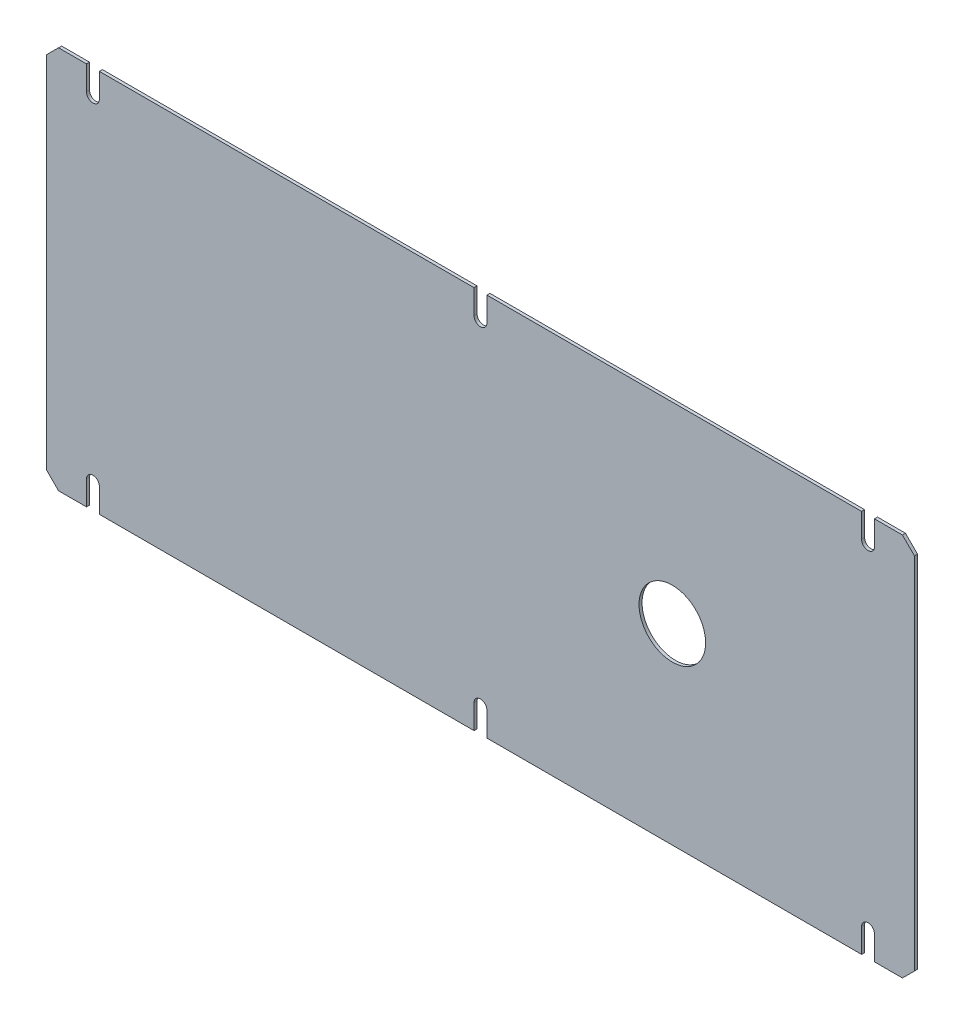
from build123d import *

# Parameters (mm, degrees)
SKETCH1_W               = 455.168
SKETCH1_H               = 201.168
BOSS_EXTRUDE1_DEPTH     = 1.5875
F_1_4_CLEARANCE_HOLE1_D = 6.7564
CUT_EXTRUDE1_REACH      = 250.826
SKETCH4_R               = 17.4625
F_1_4_CLEARANCE_HOLE2_D = 6.7564
CUT_EXTRUDE2_REACH      = 250.826
SKETCH7_W               = 6.7564
SKETCH7_H               = 14.478
CHAMFER1_SIZE           = 6.35


with BuildPart() as part:
    # Sketch1 → Boss-Extrude1 (new body)
    with BuildSketch(Plane.XY):
        Rectangle(SKETCH1_W, SKETCH1_H)
    extrude(amount=BOSS_EXTRUDE1_DEPTH)

    # 1/4 Clearance Hole1 (through all)
    with Locations(Plane.XY.offset(1.5875)):
        with Locations((-203.2, 87.884), (203.2, 87.884), (-203.2, -87.884), (203.2, -87.884)):
            Hole(F_1_4_CLEARANCE_HOLE1_D / 2)

    # Sketch4 → Cut-Extrude1 (cut, up to next)
    with BuildSketch(Plane.XY.offset(1.5875), mode=Mode.PRIVATE) as cut_extrude1_sk1:
        with Locations((100.584, 0)):
            Circle(SKETCH4_R)
    cut_extrude1_tool1 = extrude(cut_extrude1_sk1.sketch, amount=-CUT_EXTRUDE1_REACH, mode=Mode.PRIVATE) & part.part
    add(cut_extrude1_tool1.solids().sort_by_distance((100.584, 0, 1.5875))[0], mode=Mode.SUBTRACT)

    # 1/4 Clearance Hole2 (through all)
    with Locations(Plane.XY.offset(1.5875)):
        with Locations((0, -87.884), (0, 87.884)):
            Hole(F_1_4_CLEARANCE_HOLE2_D / 2)

    # Sketch7 → Cut-Extrude2 (cut, up to next)
    with BuildSketch(Plane.XY.offset(1.5875), mode=Mode.PRIVATE) as cut_extrude2_sk1:
        with Locations((-203.2, -95.123)):
            Rectangle(SKETCH7_W, SKETCH7_H)
    cut_extrude2_tool1 = extrude(cut_extrude2_sk1.sketch, amount=-CUT_EXTRUDE2_REACH, mode=Mode.PRIVATE) & part.part
    # Sketch7 → Cut-Extrude2 (cut, up to next)
    with BuildSketch(Plane.XY.offset(1.5875), mode=Mode.PRIVATE) as cut_extrude2_sk2:
        with Locations((0, -95.123)):
            Rectangle(SKETCH7_W, SKETCH7_H)
    cut_extrude2_tool2 = extrude(cut_extrude2_sk2.sketch, amount=-CUT_EXTRUDE2_REACH, mode=Mode.PRIVATE) & part.part
    # Sketch7 → Cut-Extrude2 (cut, up to next)
    with BuildSketch(Plane.XY.offset(1.5875), mode=Mode.PRIVATE) as cut_extrude2_sk3:
        with Locations((203.2, -95.123)):
            Rectangle(SKETCH7_W, SKETCH7_H)
    cut_extrude2_tool3 = extrude(cut_extrude2_sk3.sketch, amount=-CUT_EXTRUDE2_REACH, mode=Mode.PRIVATE) & part.part
    cut_extrude2_1 = cut_extrude2_tool1.solids().sort_by_distance((-203.2, -95.123, 1.5875))[0]
    add(cut_extrude2_1, mode=Mode.SUBTRACT)
    cut_extrude2_2 = cut_extrude2_tool2.solids().sort_by_distance((0, -95.123, 1.5875))[0]
    add(cut_extrude2_2, mode=Mode.SUBTRACT)
    cut_extrude2_3 = cut_extrude2_tool3.solids().sort_by_distance((203.2, -95.123, 1.5875))[0]
    add(cut_extrude2_3, mode=Mode.SUBTRACT)
    cut_extrude2 = cut_extrude2_1 + cut_extrude2_2 + cut_extrude2_3  # Cut-Extrude2 as one shape, for the pattern or mirror that repeats it

    # Mirror1: Cut-Extrude2 across plane
    add(cut_extrude2.mirror(Plane.ZX), mode=Mode.SUBTRACT)

    # Chamfer1
    chamfer1_edges = [part.edges().sort_by_distance(p)[0] for p in [
        (227.584, -100.584, 0.79375),
        (-227.584, -100.584, 0.79375),
        (-227.584, 100.584, 0.79375),
        (227.584, 100.584, 0.79375),
    ]]
    chamfer(chamfer1_edges, length=CHAMFER1_SIZE)


solid = part.part
